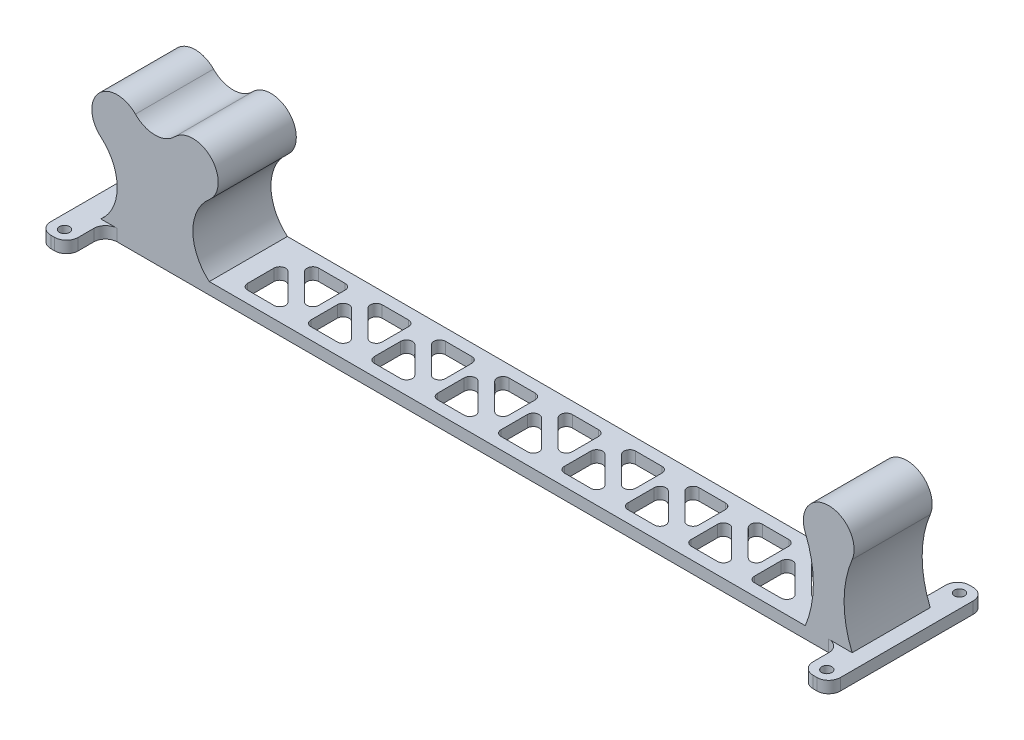
from build123d import *

# Parameters (mm, degrees)
SKETCH1_R           = 3.3734375
BOSS_EXTRUDE1_DEPTH = 20
BOSS_EXTRUDE2_START = 17
SKETCH1_3_R         = 3.3734375
BOSS_EXTRUDE2_DEPTH = 3
CUT_EXTRUDE1_DEPTH  = 177.521109503
SKETCH3_W           = 7
SKETCH3_H           = 10
SKETCH3_R           = 1.3
BOSS_EXTRUDE3_DEPTH = 3
FILLET1_R           = 3


with BuildPart() as part:
    # Sketch1 → Boss-Extrude1 (new body)
    with BuildSketch(Plane.XY):
        with BuildLine():
            Line((4.208615455, -23.15), (156.86, -23.15))
            ThreePointArc((156.86, -23.15), (158.925, -12.825), (156.86, -2.5))
            ThreePointArc((156.86, -2.5), (162.86, 6.5), (168.86, -2.5))
            ThreePointArc((168.86, -2.5), (166.795, -12.825), (168.86, -23.15))
            Line((168.86, -23.15), (172.86, -23.15))
            Line((172.86, -23.15), (172.86, -26.15))
            Line((172.86, -26.15), (-29.38, -26.15))
            Line((-29.38, -26.15), (-29.38, -23.15))
            Line((-29.38, -23.15), (-23.588615455, -23.15))
            ThreePointArc((-23.588615455, -23.15), (-19.38, -14.05176987), (-23.588615455, -4.953539739))
            ThreePointArc((-23.588615455, -4.953539739), (-24.125158102, 4.442237565), (-14.714444444, 4.525769698))
            ThreePointArc((-14.714444444, 4.525769698), (-9.69, 2.399675526), (-4.665555556, 4.525769698))
            ThreePointArc((-4.665555556, 4.525769698), (4.745158102, 4.442237565), (4.208615455, -4.953539739))
            ThreePointArc((4.208615455, -4.953539739), (0, -14.05176987), (4.208615455, -23.15))
        make_face()
        Circle(SKETCH1_R, mode=Mode.SUBTRACT)
        with Locations((-19.38, 0)):
            Circle(SKETCH1_R, mode=Mode.SUBTRACT)
        with Locations((162.86, 0)):
            Circle(SKETCH1_R, mode=Mode.SUBTRACT)
    extrude(amount=BOSS_EXTRUDE1_DEPTH)

    # Sketch1<3> → Boss-Extrude2 (add)
    # profile 1 of 4: a face of its own
    with BuildSketch(Plane.XY.offset(BOSS_EXTRUDE2_START)):
        with BuildLine():
            ThreePointArc((168.86, -2.5), (162.86, 6.5), (156.86, -2.5))
            ThreePointArc((156.86, -2.5), (158.925, -12.825), (156.86, -23.15))
            Line((156.86, -23.15), (4.208615455, -23.15))
            ThreePointArc((4.208615455, -23.15), (0, -14.05176987), (4.208615455, -4.953539739))
            ThreePointArc((4.208615455, -4.953539739), (4.745158102, 4.442237565), (-4.665555556, 4.525769698))
            ThreePointArc((-4.665555556, 4.525769698), (-9.69, 2.399675526), (-14.714444444, 4.525769698))
            ThreePointArc((-14.714444444, 4.525769698), (-24.125158102, 4.442237565), (-23.588615455, -4.953539739))
            ThreePointArc((-23.588615455, -4.953539739), (-19.38, -14.05176987), (-23.588615455, -23.15))
            Line((-23.588615455, -23.15), (-29.38, -23.15))
            Line((-29.38, -23.15), (-29.38, -26.15))
            Line((-29.38, -26.15), (172.86, -26.15))
            Line((172.86, -26.15), (172.86, -23.15))
            Line((172.86, -23.15), (168.86, -23.15))
            ThreePointArc((168.86, -23.15), (166.795, -12.825), (168.86, -2.5))
        make_face()
        Circle(SKETCH1_3_R, mode=Mode.SUBTRACT)
        with Locations((-19.38, 0)):
            Circle(SKETCH1_3_R, mode=Mode.SUBTRACT)
        with Locations((162.86, 0)):
            Circle(SKETCH1_3_R, mode=Mode.SUBTRACT)
    # profile 2 of 4: a face of its own
    with BuildSketch(Plane.XY.offset(BOSS_EXTRUDE2_START)):
        Circle(SKETCH1_3_R)
    # profile 3 of 4: a face of its own
    with BuildSketch(Plane.XY.offset(BOSS_EXTRUDE2_START)):
        with Locations((-19.38, 0)):
            Circle(SKETCH1_3_R)
    # profile 4 of 4: a face of its own
    with BuildSketch(Plane.XY.offset(BOSS_EXTRUDE2_START)):
        with Locations((162.86, 0)):
            Circle(SKETCH1_3_R)
    extrude(amount=BOSS_EXTRUDE2_DEPTH)

    # Sketch2 → Cut-Extrude1 (cut, through all)
    with BuildSketch(Plane(origin=(0, -23.15, 0), x_dir=(1, 0, 0), z_dir=(0, 1, 0))):
        with BuildLine():
            Line((9.5, -8.742640687), (9.5, -15.5))
            ThreePointArc((9.5, -15.5), (9.939339828, -16.560660172), (11, -17))
            Line((11, -17), (17.757359313, -17))
            ThreePointArc((17.757359313, -17), (19.143178612, -16.074025149), (18.818019485, -14.439339828))
            Line((18.818019485, -14.439339828), (12.060660172, -7.681980515))
            ThreePointArc((12.060660172, -7.681980515), (10.425974851, -7.356821388), (9.5, -8.742640687))
        make_face()
        with BuildLine():
            Line((23.5, -4.5), (23.5, -11.257359313))
            ThreePointArc((23.5, -11.257359313), (22.574025149, -12.643178612), (20.939339828, -12.318019485))
            Line((20.939339828, -12.318019485), (14.181980515, -5.560660172))
            ThreePointArc((14.181980515, -5.560660172), (13.856821388, -3.925974851), (15.242640687, -3))
            Line((15.242640687, -3), (22, -3))
            ThreePointArc((22, -3), (23.060660172, -3.439339828), (23.5, -4.5))
        make_face()
        with BuildLine():
            Line((35.050519485, -14.439339828), (28.293160172, -7.681980515))
            ThreePointArc((28.293160172, -7.681980515), (26.658474851, -7.356821388), (25.7325, -8.742640687))
            Line((25.7325, -8.742640687), (25.7325, -15.5))
            ThreePointArc((25.7325, -15.5), (26.171839828, -16.560660172), (27.2325, -17))
            Line((27.2325, -17), (33.989859313, -17))
            ThreePointArc((33.989859313, -17), (35.375678612, -16.074025149), (35.050519485, -14.439339828))
        make_face()
        with BuildLine():
            Line((39.7325, -4.5), (39.7325, -11.257359313))
            ThreePointArc((39.7325, -11.257359313), (38.806525149, -12.643178612), (37.171839828, -12.318019485))
            Line((37.171839828, -12.318019485), (30.414480515, -5.560660172))
            ThreePointArc((30.414480515, -5.560660172), (30.089321388, -3.925974851), (31.475140687, -3))
            Line((31.475140687, -3), (38.2325, -3))
            ThreePointArc((38.2325, -3), (39.293160172, -3.439339828), (39.7325, -4.5))
        make_face()
        with BuildLine():
            Line((51.283019485, -14.439339828), (44.525660172, -7.681980515))
            ThreePointArc((44.525660172, -7.681980515), (42.890974851, -7.356821388), (41.965, -8.742640687))
            Line((41.965, -8.742640687), (41.965, -15.5))
            ThreePointArc((41.965, -15.5), (42.404339828, -16.560660172), (43.465, -17))
            Line((43.465, -17), (50.222359313, -17))
            ThreePointArc((50.222359313, -17), (51.608178612, -16.074025149), (51.283019485, -14.439339828))
        make_face()
        with BuildLine():
            Line((55.965, -4.5), (55.965, -11.257359313))
            ThreePointArc((55.965, -11.257359313), (55.039025149, -12.643178612), (53.404339828, -12.318019485))
            Line((53.404339828, -12.318019485), (46.646980515, -5.560660172))
            ThreePointArc((46.646980515, -5.560660172), (46.321821388, -3.925974851), (47.707640687, -3))
            Line((47.707640687, -3), (54.465, -3))
            ThreePointArc((54.465, -3), (55.525660172, -3.439339828), (55.965, -4.5))
        make_face()
        with BuildLine():
            Line((67.515519485, -14.439339828), (60.758160172, -7.681980515))
            ThreePointArc((60.758160172, -7.681980515), (59.123474851, -7.356821388), (58.1975, -8.742640687))
            Line((58.1975, -8.742640687), (58.1975, -15.5))
            ThreePointArc((58.1975, -15.5), (58.636839828, -16.560660172), (59.6975, -17))
            Line((59.6975, -17), (66.454859313, -17))
            ThreePointArc((66.454859313, -17), (67.840678612, -16.074025149), (67.515519485, -14.439339828))
        make_face()
        with BuildLine():
            Line((72.1975, -4.5), (72.1975, -11.257359313))
            ThreePointArc((72.1975, -11.257359313), (71.271525149, -12.643178612), (69.636839828, -12.318019485))
            Line((69.636839828, -12.318019485), (62.879480515, -5.560660172))
            ThreePointArc((62.879480515, -5.560660172), (62.554321388, -3.925974851), (63.940140687, -3))
            Line((63.940140687, -3), (70.6975, -3))
            ThreePointArc((70.6975, -3), (71.758160172, -3.439339828), (72.1975, -4.5))
        make_face()
        with BuildLine():
            Line((83.748019485, -14.439339828), (76.990660172, -7.681980515))
            ThreePointArc((76.990660172, -7.681980515), (75.355974851, -7.356821388), (74.43, -8.742640687))
            Line((74.43, -8.742640687), (74.43, -15.5))
            ThreePointArc((74.43, -15.5), (74.869339828, -16.560660172), (75.93, -17))
            Line((75.93, -17), (82.687359313, -17))
            ThreePointArc((82.687359313, -17), (84.073178612, -16.074025149), (83.748019485, -14.439339828))
        make_face()
        with BuildLine():
            Line((88.43, -4.5), (88.43, -11.257359313))
            ThreePointArc((88.43, -11.257359313), (87.504025149, -12.643178612), (85.869339828, -12.318019485))
            Line((85.869339828, -12.318019485), (79.111980515, -5.560660172))
            ThreePointArc((79.111980515, -5.560660172), (78.786821388, -3.925974851), (80.172640687, -3))
            Line((80.172640687, -3), (86.93, -3))
            ThreePointArc((86.93, -3), (87.990660172, -3.439339828), (88.43, -4.5))
        make_face()
        with BuildLine():
            Line((99.980519485, -14.439339828), (93.223160172, -7.681980515))
            ThreePointArc((93.223160172, -7.681980515), (91.588474851, -7.356821388), (90.6625, -8.742640687))
            Line((90.6625, -8.742640687), (90.6625, -15.5))
            ThreePointArc((90.6625, -15.5), (91.101839828, -16.560660172), (92.1625, -17))
            Line((92.1625, -17), (98.919859313, -17))
            ThreePointArc((98.919859313, -17), (100.305678612, -16.074025149), (99.980519485, -14.439339828))
        make_face()
        with BuildLine():
            Line((104.6625, -4.5), (104.6625, -11.257359313))
            ThreePointArc((104.6625, -11.257359313), (103.736525149, -12.643178612), (102.101839828, -12.318019485))
            Line((102.101839828, -12.318019485), (95.344480515, -5.560660172))
            ThreePointArc((95.344480515, -5.560660172), (95.019321388, -3.925974851), (96.405140687, -3))
            Line((96.405140687, -3), (103.1625, -3))
            ThreePointArc((103.1625, -3), (104.223160172, -3.439339828), (104.6625, -4.5))
        make_face()
        with BuildLine():
            Line((116.213019485, -14.439339828), (109.455660172, -7.681980515))
            ThreePointArc((109.455660172, -7.681980515), (107.820974851, -7.356821388), (106.895, -8.742640687))
            Line((106.895, -8.742640687), (106.895, -15.5))
            ThreePointArc((106.895, -15.5), (107.334339828, -16.560660172), (108.395, -17))
            Line((108.395, -17), (115.152359313, -17))
            ThreePointArc((115.152359313, -17), (116.538178612, -16.074025149), (116.213019485, -14.439339828))
        make_face()
        with BuildLine():
            Line((120.895, -4.5), (120.895, -11.257359313))
            ThreePointArc((120.895, -11.257359313), (119.969025149, -12.643178612), (118.334339828, -12.318019485))
            Line((118.334339828, -12.318019485), (111.576980515, -5.560660172))
            ThreePointArc((111.576980515, -5.560660172), (111.251821388, -3.925974851), (112.637640687, -3))
            Line((112.637640687, -3), (119.395, -3))
            ThreePointArc((119.395, -3), (120.455660172, -3.439339828), (120.895, -4.5))
        make_face()
        with BuildLine():
            Line((132.445519485, -14.439339828), (125.688160172, -7.681980515))
            ThreePointArc((125.688160172, -7.681980515), (124.053474851, -7.356821388), (123.1275, -8.742640687))
            Line((123.1275, -8.742640687), (123.1275, -15.5))
            ThreePointArc((123.1275, -15.5), (123.566839828, -16.560660172), (124.6275, -17))
            Line((124.6275, -17), (131.384859313, -17))
            ThreePointArc((131.384859313, -17), (132.770678612, -16.074025149), (132.445519485, -14.439339828))
        make_face()
        with BuildLine():
            Line((137.1275, -4.5), (137.1275, -11.257359313))
            ThreePointArc((137.1275, -11.257359313), (136.201525149, -12.643178612), (134.566839828, -12.318019485))
            Line((134.566839828, -12.318019485), (127.809480515, -5.560660172))
            ThreePointArc((127.809480515, -5.560660172), (127.484321388, -3.925974851), (128.870140687, -3))
            Line((128.870140687, -3), (135.6275, -3))
            ThreePointArc((135.6275, -3), (136.688160172, -3.439339828), (137.1275, -4.5))
        make_face()
        with BuildLine():
            Line((148.678019485, -14.439339828), (141.920660172, -7.681980515))
            ThreePointArc((141.920660172, -7.681980515), (140.285974851, -7.356821388), (139.36, -8.742640687))
            Line((139.36, -8.742640687), (139.36, -15.5))
            ThreePointArc((139.36, -15.5), (139.799339828, -16.560660172), (140.86, -17))
            Line((140.86, -17), (147.617359313, -17))
            ThreePointArc((147.617359313, -17), (149.003178612, -16.074025149), (148.678019485, -14.439339828))
        make_face()
        with BuildLine():
            Line((153.36, -4.5), (153.36, -11.257359313))
            ThreePointArc((153.36, -11.257359313), (152.434025149, -12.643178612), (150.799339828, -12.318019485))
            Line((150.799339828, -12.318019485), (144.041980515, -5.560660172))
            ThreePointArc((144.041980515, -5.560660172), (143.716821388, -3.925974851), (145.102640687, -3))
            Line((145.102640687, -3), (151.86, -3))
            ThreePointArc((151.86, -3), (152.920660172, -3.439339828), (153.36, -4.5))
        make_face()
    extrude(amount=-CUT_EXTRUDE1_DEPTH, mode=Mode.SUBTRACT)

    # Sketch3 → Boss-Extrude3 (add)
    # profile 1 of 4: a face of its own
    with BuildSketch(Plane(origin=(0, -23.15, 0), x_dir=(1, 0, 0), z_dir=(0, 1, 0))):
        with Locations((-25.88, -25)):
            Rectangle(SKETCH3_W, SKETCH3_H)
        with Locations(Location((-25.88, -27, 0), (0, 0, 180))):
            Circle(SKETCH3_R, mode=Mode.SUBTRACT)
    # profile 2 of 4: a face of its own
    with BuildSketch(Plane(origin=(0, -23.15, 0), x_dir=(1, 0, 0), z_dir=(0, 1, 0))):
        with Locations((-25.88, 5)):
            Rectangle(SKETCH3_W, SKETCH3_H)
        with Locations(Location((-25.88, 7, 0), (0, 0, 180))):
            Circle(SKETCH3_R, mode=Mode.SUBTRACT)
    # profile 3 of 4: a face of its own
    with BuildSketch(Plane(origin=(0, -23.15, 0), x_dir=(1, 0, 0), z_dir=(0, 1, 0))):
        with Locations((169.36, -25)):
            Rectangle(SKETCH3_W, SKETCH3_H)
        with Locations(Location((169.36, -27, 0), (0, 0, 180))):
            Circle(SKETCH3_R, mode=Mode.SUBTRACT)
    # profile 4 of 4: a face of its own
    with BuildSketch(Plane(origin=(0, -23.15, 0), x_dir=(1, 0, 0), z_dir=(0, 1, 0))):
        with Locations((169.36, 5)):
            Rectangle(SKETCH3_W, SKETCH3_H)
        with Locations(Location((169.36, 7, 0), (0, 0, 180))):
            Circle(SKETCH3_R, mode=Mode.SUBTRACT)
    extrude(amount=-BOSS_EXTRUDE3_DEPTH)

    # Fillet1
    fillet1_edges = [part.edges().sort_by_distance(p)[0] for p in [
        (-22.38, -24.65, 20),
        (-22.38, -24.65, 30),
        (-29.38, -24.65, 30),
        (-22.38, -24.65, 0),
        (-29.38, -24.65, -10),
        (-22.38, -24.65, -10),
        (172.86, -24.65, 30),
        (165.86, -24.65, 30),
        (165.86, -24.65, 20),
        (165.86, -24.65, 0),
        (165.86, -24.65, -10),
        (172.86, -24.65, -10),
    ]]
    fillet(fillet1_edges, radius=FILLET1_R)


solid = part.part
